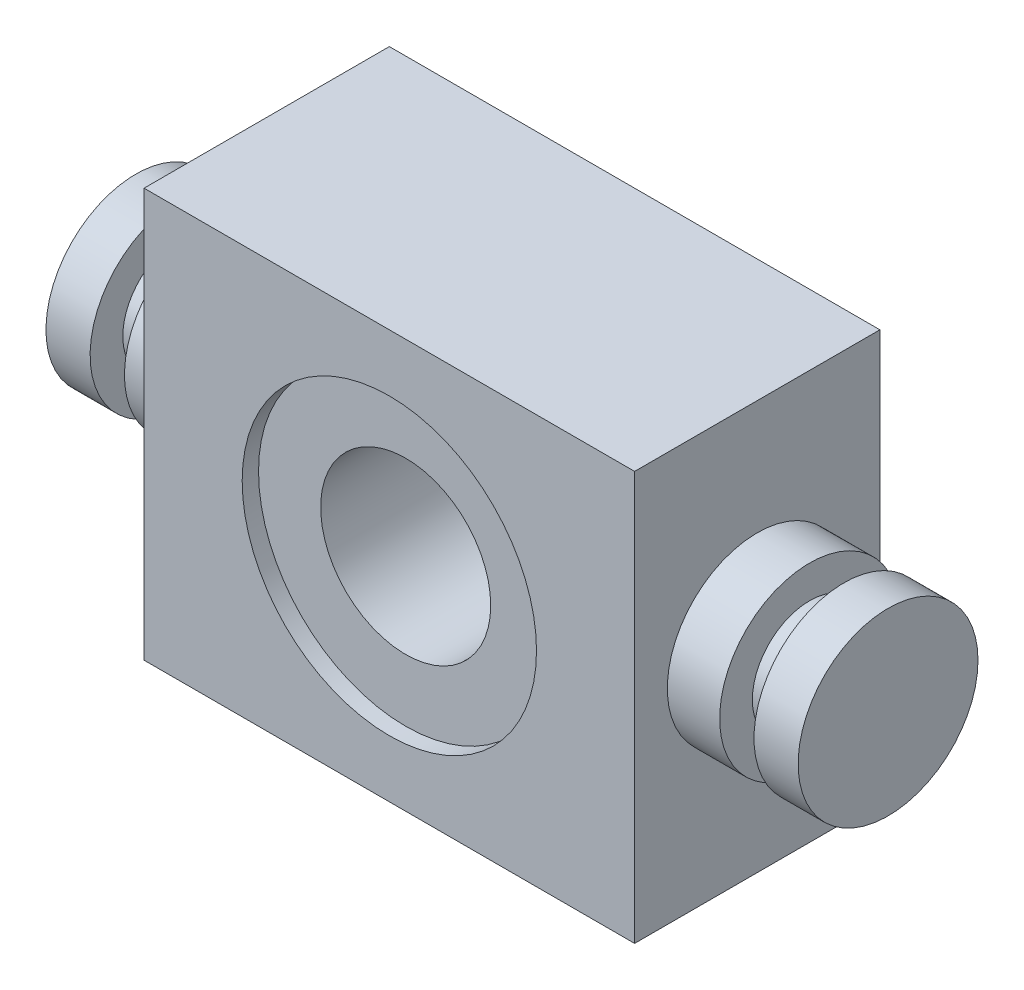
from build123d import *

# Parameters (mm, degrees)
SKETCH1_W            = 150
SKETCH1_H            = 125
SKETCH1_R            = 45
BOSS_EXTRUDE2_DEPTH  = 75
SKETCH1_5_R          = 45
SKETCH1_5_R_2        = 26
BOSS_EXTRUDE3_DEPTH  = 70
SKETCH6_R            = 27.5
BOSS_EXTRUDE5_DEPTH  = 16
SKETCH7_R            = 17.5
BOSS_EXTRUDE6_DEPTH  = 10.5
SKETCH8_R            = 27.5
BOSS_EXTRUDE7_DEPTH  = 13.5
BOSS_EXTRUDE8_START  = 16
SKETCH9_R            = 27.5
BOSS_EXTRUDE8_DEPTH  = 16
BOSS_EXTRUDE9_START  = 10.5
SKETCH10_R           = 17.5
BOSS_EXTRUDE9_DEPTH  = 10.5
BOSS_EXTRUDE10_START = 13.5
SKETCH11_R           = 27.5
BOSS_EXTRUDE10_DEPTH = 13.5


with BuildPart() as part:
    # Sketch1 → Boss-Extrude2 (new body)
    with BuildSketch(Plane.XY):
        Rectangle(SKETCH1_W, SKETCH1_H)
        Circle(SKETCH1_R, mode=Mode.SUBTRACT)
    extrude(amount=BOSS_EXTRUDE2_DEPTH)

    # Sketch1<5> → Boss-Extrude3 (add)
    with BuildSketch(Plane.XY):
        Circle(SKETCH1_5_R)
        Circle(SKETCH1_5_R_2, mode=Mode.SUBTRACT)
    extrude(amount=BOSS_EXTRUDE3_DEPTH)

    # Sketch6 → Boss-Extrude5 (add)
    with BuildSketch(Plane(origin=(75, 0, 0), x_dir=(0, 0, -1), z_dir=(1, 0, 0))):
        with Locations((-37.5, 0)):
            Circle(SKETCH6_R)
    extrude(amount=BOSS_EXTRUDE5_DEPTH)

    # Sketch7 → Boss-Extrude6 (add)
    with BuildSketch(Plane(origin=(91, 0, 0), x_dir=(0, 0, -1), z_dir=(1, 0, 0))):
        with Locations((-37.5, 0)):
            Circle(SKETCH7_R)
    extrude(amount=BOSS_EXTRUDE6_DEPTH)

    # Sketch8 → Boss-Extrude7 (add)
    with BuildSketch(Plane(origin=(101.5, 0, 0), x_dir=(0, 0, -1), z_dir=(1, 0, 0))):
        with Locations((-37.5, 0)):
            Circle(SKETCH8_R)
    extrude(amount=BOSS_EXTRUDE7_DEPTH)

    # Sketch9 → Boss-Extrude8 (add)
    with BuildSketch(Plane.ZY.offset(75).offset(BOSS_EXTRUDE8_START)):
        with Locations((37.5, 0)):
            Circle(SKETCH9_R)
    extrude(amount=-BOSS_EXTRUDE8_DEPTH)

    # Sketch10 → Boss-Extrude9 (add)
    with BuildSketch(Plane.ZY.offset(91).offset(BOSS_EXTRUDE9_START)):
        with Locations((37.5, 0)):
            Circle(SKETCH10_R)
    extrude(amount=-BOSS_EXTRUDE9_DEPTH)

    # Sketch11 → Boss-Extrude10 (add)
    with BuildSketch(Plane.ZY.offset(101.5).offset(BOSS_EXTRUDE10_START)):
        with Locations((37.5, 0)):
            Circle(SKETCH11_R)
    extrude(amount=-BOSS_EXTRUDE10_DEPTH)


solid = part.part
